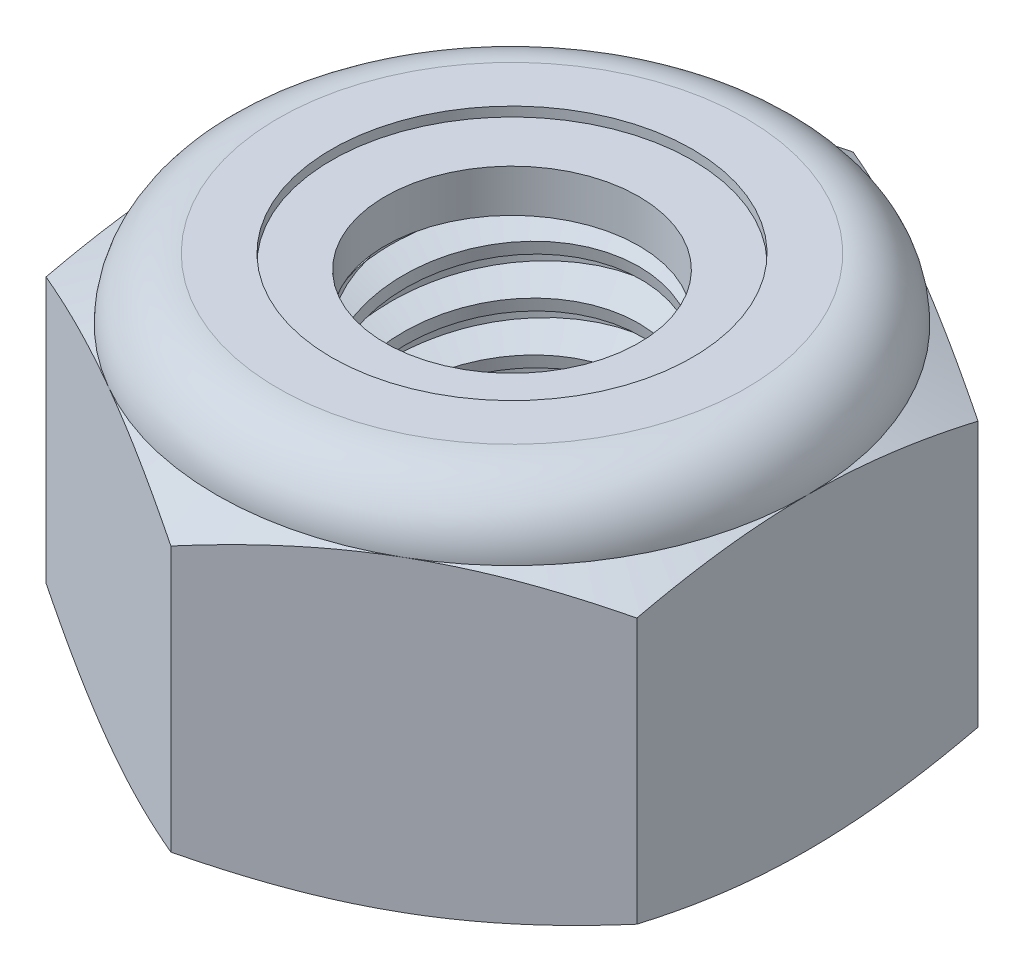
from build123d import *

# Parameters (mm, degrees)
EXTRUDE1_DEPTH      = 5.953125
SKETCH2_W           = 2.413
SKETCH2_H           = 5.953125
LPATTERN1_COUNT     = 8
LPATTERN1_PITCH     = 0.79375
LPATTERN1_COL_COUNT = 2
LPATTERN1_COL_PITCH = 0.79375


with BuildPart() as part:
    # Sketch1 → Extrude1 (new body)
    with BuildSketch(Plane(origin=(0, 0, 0), x_dir=(1, 0, 0), z_dir=(0, 1, 0))):
        Polygon((0, 5.499261314), (-4.7625, 2.749630657), (-4.7625, -2.749630657), (0, -5.499261314), (4.7625, -2.749630657), (4.7625, 2.749630657), align=None)
    extrude(amount=EXTRUDE1_DEPTH)

    # Sketch4 → Cut-Revolve2 (revolve, cut)
    with BuildSketch(Plane(origin=(0, 0, 0), x_dir=(0, 0, -1), z_dir=(1, 0, 0)), mode=Mode.PRIVATE) as cut_revolve2_sk:
        Polygon((0, 5.953125), (2.413, 5.953125), (2.045424837, 5.781721887), (2.045424837, 0.171403113), (2.413, 0), (0, 0), align=None)
    revolve(cut_revolve2_sk.sketch.rotate(Axis((0, 5.953125, 0), (0, 1, 0)), 55.135741266), axis=Axis((0, 5.953125, 0), (0, 1, 0)), mode=Mode.SUBTRACT)


with BuildPart() as body_2:
    # Sketch2 → Revolve1 (revolve)
    with BuildSketch(Plane(origin=(0, 0, 0), x_dir=(0, 0, -1), z_dir=(1, 0, 0))):
        with Locations((1.2065, 2.9765625)):
            Rectangle(SKETCH2_W, SKETCH2_H)
    revolve(axis=Axis((0, -2.413, 0), (0, 1, 0)))

    # Sketch3 → Cut-Revolve1 (revolve, cut)
    with BuildSketch(Plane(origin=(0, 0, 0), x_dir=(0, 0, -1), z_dir=(1, 0, 0)), mode=Mode.PRIVATE) as cut_revolve1_sk:
        Polygon((2.429102527, 5.855221635), (2.541820218, 5.169898076), (2.077629892, 5.344930502), (2.045424837, 5.540737233), align=None)
    cut_revolve1 = revolve(cut_revolve1_sk.sketch.rotate(Axis((0, 5.953125, 0.139697061), (0, -0.9867425810390563, -0.16229318767089806)), 180), axis=Axis((0, 5.953125, 0.139697061), (0, -0.9867425810390563, -0.16229318767089806)), mode=Mode.SUBTRACT)

    # LPattern1: Cut-Revolve1 ×8
    with Locations(*[(0, -i * LPATTERN1_PITCH, 0) for i in range(1, LPATTERN1_COUNT)]):
        add(cut_revolve1, mode=Mode.SUBTRACT)

    # LPattern1 col: Cut-Revolve1 ×2
    with Locations(*[(0, i * LPATTERN1_COL_PITCH, 0) for i in range(1, LPATTERN1_COL_COUNT)]):
        add(cut_revolve1, mode=Mode.SUBTRACT)


with BuildPart() as part_1:
    add(part.part)

    # Combine1: cut body 2
    add(body_2.part, mode=Mode.SUBTRACT)

    # Sketch5 → Cut-Revolve3 (revolve, cut)
    with BuildSketch(Plane(origin=(0, 0, 0), x_dir=(0, 0, -1), z_dir=(1, 0, 0)), mode=Mode.PRIVATE) as cut_revolve3_sk:
        with BuildLine():
            Line((0, 0), (4.7625, 0))
            Line((4.7625, 0), (5.499261314, 0.343557443))
            Line((5.499261314, 0.343557443), (5.499261314, 4.617380057))
            Line((5.499261314, 4.617380057), (4.7625, 4.9609375))
            ThreePointArc((4.7625, 4.9609375), (4.471895009, 5.662520009), (3.7703125, 5.953125))
            Line((3.7703125, 5.953125), (3.7703125, 7.223125))
            Line((3.7703125, 7.223125), (6.769261314, 7.223125))
            Line((6.769261314, 7.223125), (6.769261314, -1.27))
            Line((6.769261314, -1.27), (0, -1.27))
            Line((0, -1.27), (0, 0))
        make_face()
    revolve(cut_revolve3_sk.sketch.rotate(Axis((0, 0, 0), (0, 1, 0)), 55.135741266), axis=Axis((0, 0, 0), (0, 1, 0)), mode=Mode.SUBTRACT)

    # Sketch6 → Cut-Revolve4 (revolve, cut)
    with BuildSketch(Plane(origin=(0, 0, 0), x_dir=(0, 0, -1), z_dir=(1, 0, 0)), mode=Mode.PRIVATE) as cut_revolve4_sk:
        with BuildLine():
            Line((0, 4.9609375), (4.6101, 4.9609375))
            ThreePointArc((4.6101, 4.9609375), (4.364131936, 5.554756936), (3.7703125, 5.800725))
            Line((3.7703125, 5.800725), (2.907868669, 5.800725))
            Line((2.907868669, 5.800725), (2.907868669, 7.223125))
            Line((2.907868669, 7.223125), (0, 7.223125))
            Line((0, 7.223125), (0, 4.9609375))
        make_face()
    revolve(cut_revolve4_sk.sketch.rotate(Axis((0, 7.223125, 0), (0, 1, 0)), 55.135741266), axis=Axis((0, 7.223125, 0), (0, 1, 0)), mode=Mode.SUBTRACT)


with BuildPart() as body_2_2:
    # Sketch7 → Revolve2 (revolve)
    with BuildSketch(Plane(origin=(0, 0, 0), x_dir=(0, 0, -1), z_dir=(1, 0, 0))):
        with BuildLine():
            Line((2.045424837, 5.0371375), (4.530088408, 5.0371375))
            ThreePointArc((4.530088408, 5.0371375), (4.282601726, 5.527175629), (3.7703125, 5.724525))
            Line((3.7703125, 5.724525), (2.045424837, 5.724525))
            Line((2.045424837, 5.724525), (2.045424837, 5.0371375))
        make_face()
    revolve(axis=Axis((0, 5.0371375, 0), (0, 1, 0)))


solid = Compound([part_1.part, body_2_2.part])
